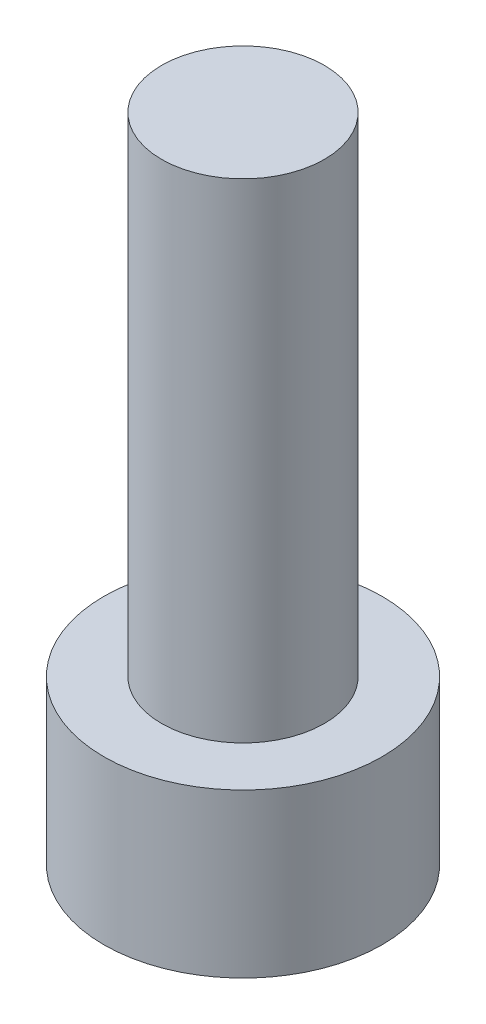
from build123d import *

# Parameters (mm, degrees)
SKETCH1_R           = 3.415
BOSS_EXTRUDE1_DEPTH = 4
SKETCH2_R           = 2
BOSS_EXTRUDE2_DEPTH = 12


with BuildPart() as part:
    # Sketch1 → Boss-Extrude1 (new body)
    with BuildSketch(Plane(origin=(0, 0, 0), x_dir=(1, 0, 0), z_dir=(0, 1, 0))):
        with Locations(Location((0, 0, 0), (0, 0, 270))):
            Circle(SKETCH1_R)
    extrude(amount=BOSS_EXTRUDE1_DEPTH)

    # Sketch2 → Boss-Extrude2 (add)
    with BuildSketch(Plane(origin=(0, 4, 0), x_dir=(1, 0, 0), z_dir=(0, 1, 0))):
        with Locations(Location((0, 0, 0), (0, 0, 270))):
            Circle(SKETCH2_R)
    extrude(amount=BOSS_EXTRUDE2_DEPTH)


solid = part.part
